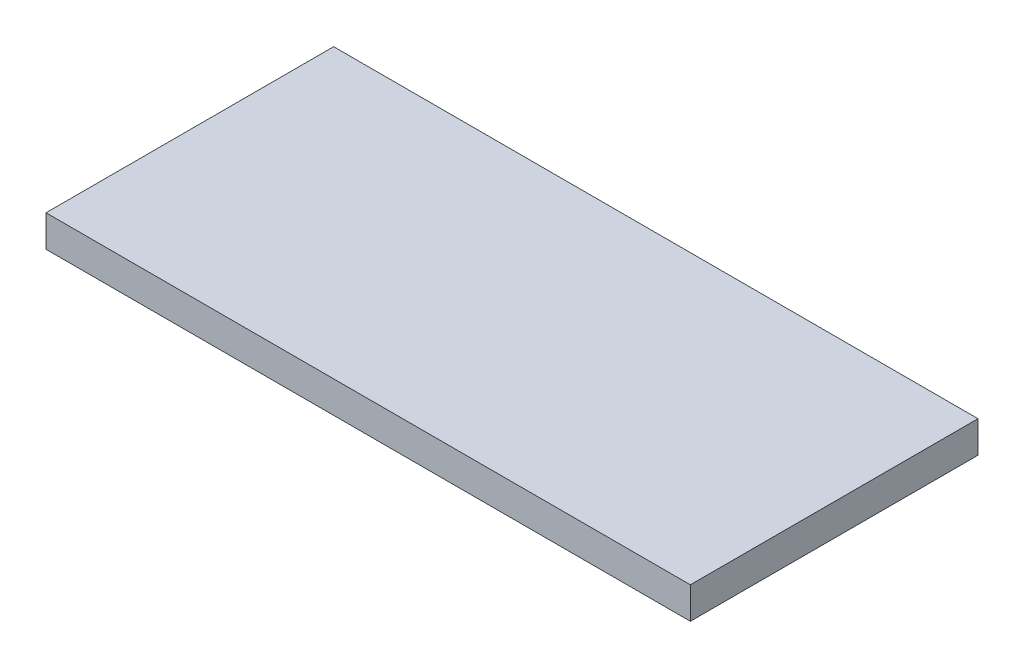
from build123d import *

# Parameters (mm, degrees)
SKETCH1_W           = 284.48
SKETCH1_H           = 127
BOSS_EXTRUDE1_DEPTH = 13.97


with BuildPart() as part:
    # Sketch1 → Boss-Extrude1 (new body)
    with BuildSketch(Plane(origin=(0, 0, 0), x_dir=(1, 0, 0), z_dir=(0, 1, 0))):
        Rectangle(SKETCH1_W, SKETCH1_H)
    extrude(amount=BOSS_EXTRUDE1_DEPTH)


solid = part.part
